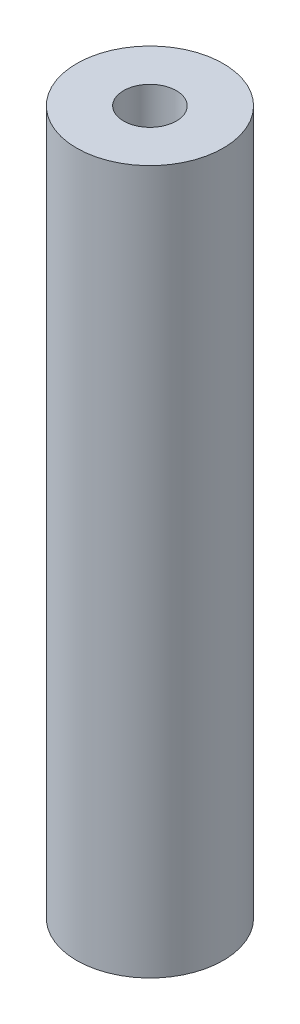
from build123d import *

# Parameters (mm, degrees)
SKETCH_2_R      = 2.5
SKETCH_2_R_2    = 0.9
EXTRUDE_1_DEPTH = 24


with BuildPart() as part:
    # 草图2 → 凸台-拉伸1 (new body)
    with BuildSketch(Plane(origin=(0, 0, 0), x_dir=(1, 0, 0), z_dir=(0, 1, 0))):
        with Locations(Location((0, 0, 0), (0, 0, 270))):
            Circle(SKETCH_2_R)
        with Locations(Location((0, 0, 0), (0, 0, 270))):
            Circle(SKETCH_2_R_2, mode=Mode.SUBTRACT)
    extrude(amount=EXTRUDE_1_DEPTH)


solid = part.part
